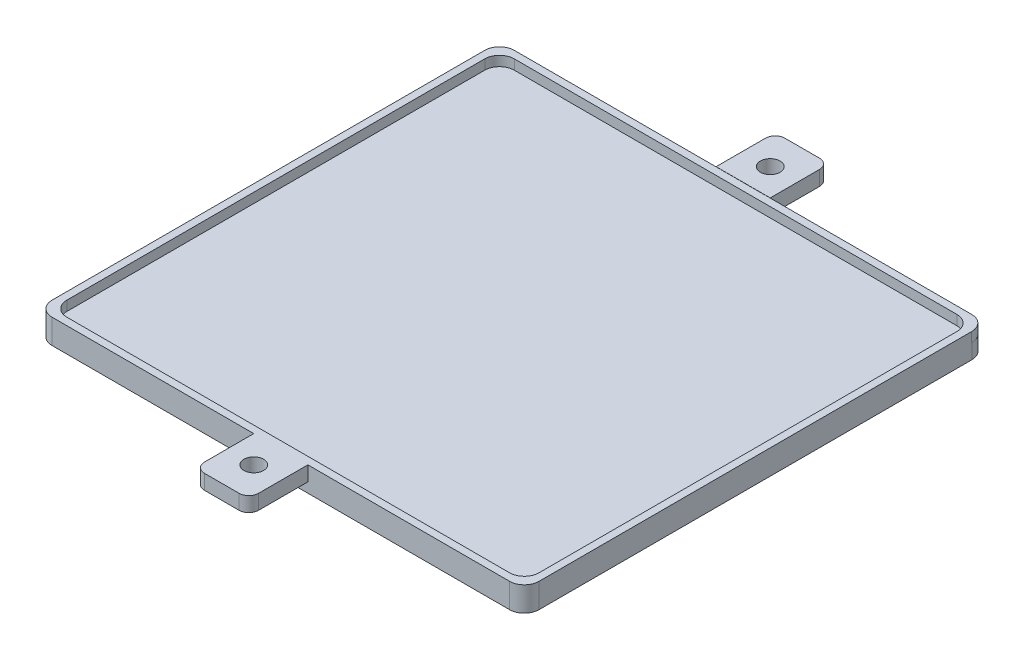
from build123d import *

# Parameters (mm, degrees)
RESSALTO_EXTRUS_O2_DEPTH = 3
RESSALTO_EXTRUS_O3_START = 2
ESBO_O1_8_R              = 2
RESSALTO_EXTRUS_O3_DEPTH = 3
RESSALTO_EXTRUS_O4_DEPTH = 2


with BuildPart() as part:
    # Esboço1 → Ressalto-extrusão2 (new body)
    with BuildSketch(Plane(origin=(0, 0, 0), x_dir=(1, 0, 0), z_dir=(0, 1, 0))):
        with BuildLine():
            ThreePointArc((-3, 0), (-2.121320344, -2.121320344), (0, -3))
            Line((0, -3), (41, -3))
            Line((41, -3), (52, -3))
            Line((52, -3), (93, -3))
            ThreePointArc((93, -3), (95.121320344, -2.121320344), (96, 0))
            Line((96, 0), (96, 38.5))
            Line((96, 38.5), (96, 49.5))
            Line((96, 49.5), (96, 88))
            ThreePointArc((96, 88), (95.121320344, 90.121320344), (93, 91))
            Line((93, 91), (52, 91))
            Line((52, 91), (41, 91))
            Line((41, 91), (0, 91))
            ThreePointArc((0, 91), (-2.121320344, 90.121320344), (-3, 88))
            Line((-3, 88), (-3, 0))
        make_face()
    extrude(amount=RESSALTO_EXTRUS_O2_DEPTH)

    # Esboço1<8> → Ressalto-extrusão3 (add)
    # profile 1 of 2: a face of its own
    with BuildSketch(Plane(origin=(0, 0, 0), x_dir=(1, 0, 0), z_dir=(0, 1, 0)).offset(RESSALTO_EXTRUS_O3_START)):
        with BuildLine():
            Line((52, -3), (41, -3))
            Line((41, -3), (41, -13))
            ThreePointArc((41, -13), (41.585786438, -14.414213562), (43, -15))
            Line((43, -15), (50, -15))
            ThreePointArc((50, -15), (51.414213562, -14.414213562), (52, -13))
            Line((52, -13), (52, -3))
        make_face()
        with Locations((46.5, -8.5)):
            Circle(ESBO_O1_8_R, mode=Mode.SUBTRACT)
    # profile 2 of 2: a face of its own
    with BuildSketch(Plane(origin=(0, 0, 0), x_dir=(1, 0, 0), z_dir=(0, 1, 0)).offset(RESSALTO_EXTRUS_O3_START)):
        with BuildLine():
            Line((41, 101), (41, 91))
            Line((41, 91), (52, 91))
            Line((52, 91), (52, 101))
            ThreePointArc((52, 101), (51.414213562, 102.414213562), (50, 103))
            Line((50, 103), (43, 103))
            ThreePointArc((43, 103), (41.585786438, 102.414213562), (41, 101))
        make_face()
        with Locations((46.5, 96.5)):
            Circle(ESBO_O1_8_R, mode=Mode.SUBTRACT)
    extrude(amount=RESSALTO_EXTRUS_O3_DEPTH)

    # Esboço2 → Ressalto-extrusão4 (add)
    with BuildSketch(Plane(origin=(0, 3, 0), x_dir=(1, 0, 0), z_dir=(0, 1, 0))):
        with BuildLine():
            Line((0, 90.960445131), (93, 90.960445131))
            ThreePointArc((93, 90.960445131), (95.121320344, 90.081765475), (96, 87.960445131))
            Line((96, 87.960445131), (96, 0))
            ThreePointArc((96, 0), (95.121320344, -2.121320344), (93, -3))
            Line((93, -3), (0, -3))
            ThreePointArc((0, -3), (-2.121320344, -2.121320344), (-3, 0))
            Line((-3, 0), (-3, 87.960445131))
            ThreePointArc((-3, 87.960445131), (-2.121320344, 90.081765475), (0, 90.960445131))
        make_face()
        with BuildLine():
            Line((1.5, 89.460445131), (91.5, 89.460445131))
            ThreePointArc((91.5, 89.460445131), (93.621320344, 88.581765475), (94.5, 86.460445131))
            Line((94.5, 86.460445131), (94.5, 1.5))
            ThreePointArc((94.5, 1.5), (93.621320344, -0.621320344), (91.5, -1.5))
            Line((91.5, -1.5), (1.5, -1.5))
            ThreePointArc((1.5, -1.5), (-0.621320344, -0.621320344), (-1.5, 1.5))
            Line((-1.5, 1.5), (-1.5, 86.460445131))
            ThreePointArc((-1.5, 86.460445131), (-0.621320344, 88.581765475), (1.5, 89.460445131))
        make_face(mode=Mode.SUBTRACT)
    extrude(amount=RESSALTO_EXTRUS_O4_DEPTH)


solid = part.part
